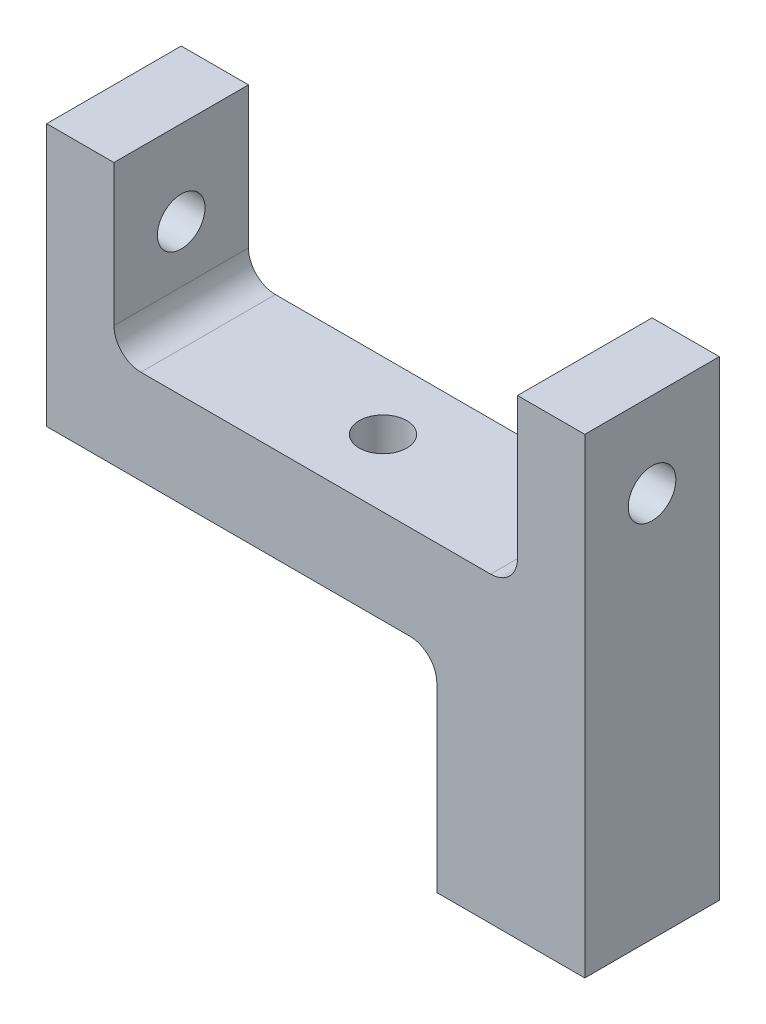
from build123d import *

# Parameters (mm, degrees)
SKETCH1_W                    = 50.8
SKETCH1_H                    = 12.7
BOSS_EXTRUDE1_DEPTH          = 44.45
SKETCH8_W                    = 13.97
SKETCH8_H                    = 19.685
SKETCH8_W_2                  = 22.86
SKETCH8_W_3                  = 38.1
SKETCH8_H_2                  = 15.875
CUT_EXTRUDE1_DEPTH           = 53.74706153
F_8_CLEARANCE_HOLE3_D        = 4.4958
F_8_CLEARANCE_HOLE2_D        = 4.4958
F_1_8_0_18_DOWEL_HOLE1_D     = 4.572
F_1_8_0_18_DOWEL_HOLE1_DEPTH = 7.62
F_1_8_0_18_DOWEL_HOLE1_TIP   = 1.373567375
FILLET1_R                    = 2.54


with BuildPart() as part:
    # Sketch1 → Boss-Extrude1 (new body)
    with BuildSketch(Plane(origin=(0, 0, 0), x_dir=(1, 0, 0), z_dir=(0, 1, 0))):
        Rectangle(SKETCH1_W, SKETCH1_H)
    extrude(amount=BOSS_EXTRUDE1_DEPTH)

    # Sketch8 → Cut-Extrude1 (cut, through all)
    with BuildSketch(Plane.XY.offset(6.35)):
        with Locations((-18.415, 9.8425)):
            Rectangle(SKETCH8_W, SKETCH8_H)
        with Locations((0, 9.8425)):
            Rectangle(SKETCH8_W_2, SKETCH8_H)
        with Locations((0, 36.5125)):
            Rectangle(SKETCH8_W_3, SKETCH8_H_2)
    extrude(amount=-CUT_EXTRUDE1_DEPTH, mode=Mode.SUBTRACT)

    # #8 Clearance Hole3 (through all)
    with Locations(Plane(origin=(25.4, 0, 0), x_dir=(0, 0, -1), z_dir=(1, 0, 0))):
        with Locations((0, 36.451492413)):
            Hole(F_8_CLEARANCE_HOLE3_D / 2)

    # #8 Clearance Hole2 (through all)
    with Locations(Plane(origin=(0, 28.575, 0), x_dir=(1, 0, 0), z_dir=(0, 1, 0))):
        with Locations((0, 0)):
            Hole(F_8_CLEARANCE_HOLE2_D / 2)

    # 1/8 (0.18) Dowel Hole1
    with Locations(Plane.ZY.offset(-11.43)):
        with Locations((0, 6.096)):
            Hole(F_1_8_0_18_DOWEL_HOLE1_D / 2, depth=F_1_8_0_18_DOWEL_HOLE1_DEPTH)
            with Locations((0, 0, -(F_1_8_0_18_DOWEL_HOLE1_DEPTH + F_1_8_0_18_DOWEL_HOLE1_TIP / 2))):  # 118° drill point
                Cone(0, F_1_8_0_18_DOWEL_HOLE1_D / 2, F_1_8_0_18_DOWEL_HOLE1_TIP, mode=Mode.SUBTRACT)

    # Fillet1
    fillet1_edges = [part.edges().sort_by_distance(p)[0] for p in [
        (11.43, 19.685, 0),
        (19.05, 28.575, 0),
        (-19.05, 28.575, 0),
    ]]
    fillet(fillet1_edges, radius=FILLET1_R)


solid = part.part
